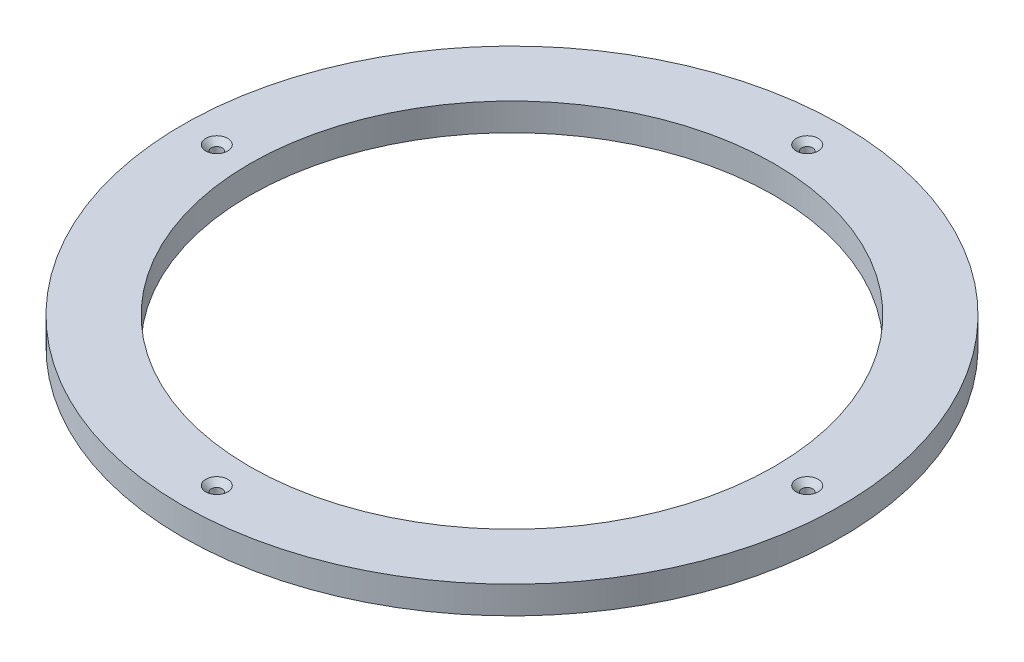
from build123d import *

# Parameters (mm, degrees)
SKETCH1_R                    = 60
BOSS_EXTRUDE1_DEPTH          = 5
SKETCH2_R                    = 1
CUT_EXTRUDE1_DEPTH           = 5
CHAMFER1_SIZE                = 1
CIRPATTERN1_COUNT            = 4
CHAMFER1_OF_CIRPATTERN1_SIZE = 1
SKETCH3_R                    = 47.75
CUT_EXTRUDE2_DEPTH           = 5


with BuildPart() as part:
    # Sketch1 → Boss-Extrude1 (new body)
    with BuildSketch(Plane(origin=(0, 0, 0), x_dir=(1, 0, 0), z_dir=(0, 1, 0))):
        with Locations(Location((0, 0, 0), (0, 0, 270))):
            Circle(SKETCH1_R)
    extrude(amount=BOSS_EXTRUDE1_DEPTH)

    # Sketch2 → Cut-Extrude1 (cut)
    with BuildSketch(Plane(origin=(0, 5, 0), x_dir=(1, 0, 0), z_dir=(0, 1, 0))):
        with Locations(Location((0, 53.75, 0), (0, 0, 270))):
            Circle(SKETCH2_R)
    cut_extrude1 = extrude(amount=-CUT_EXTRUDE1_DEPTH, mode=Mode.SUBTRACT)

    # Chamfer1
    chamfer1_edges = [part.edges().sort_by_distance(p)[0] for p in [
        (0, 5, -54.75),
    ]]
    chamfer(chamfer1_edges, length=CHAMFER1_SIZE)

    # CirPattern1: Cut-Extrude1 ×4 about axis
    cirpattern1_axis = Axis((0, 0, 0), (0, 1, 0))
    for i in range(1, CIRPATTERN1_COUNT):
        add(cut_extrude1.rotate(cirpattern1_axis, i * 360 / CIRPATTERN1_COUNT), mode=Mode.SUBTRACT)

    # Chamfer1 of CirPattern1
    chamfer1_of_cirpattern1_edges = [part.edges().sort_by_distance(p)[0] for p in [
        (-54.75, 5, 0),
        (0, 5, 54.75),
        (54.75, 5, 0),
    ]]
    chamfer(chamfer1_of_cirpattern1_edges, length=CHAMFER1_OF_CIRPATTERN1_SIZE)

    # Sketch3 → Cut-Extrude2 (cut)
    with BuildSketch(Plane(origin=(0, 5, 0), x_dir=(1, 0, 0), z_dir=(0, 1, 0))):
        with Locations(Location((0, 0, 0), (0, 0, 270))):
            Circle(SKETCH3_R)
    extrude(amount=-CUT_EXTRUDE2_DEPTH, mode=Mode.SUBTRACT)


solid = part.part
